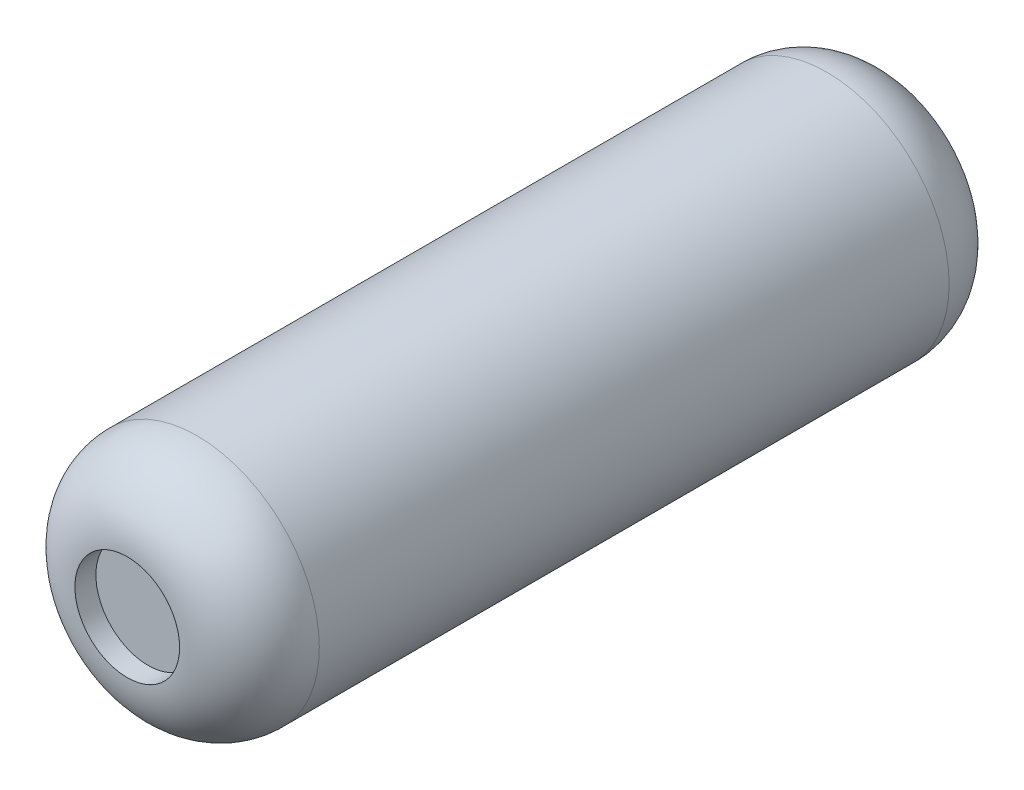
from build123d import *

# Parameters (mm, degrees)
SKETCH1_R          = 44.49044586
EXTRUDE1_DEPTH     = 280
FILLET1_R          = 25.4
SKETCH3_W          = 20
SKETCH3_H          = 10
CUT_EXTRUDE1_DEPTH = 7.62
SKETCH4_R          = 19.05
CUT_EXTRUDE2_DEPTH = 7.62


with BuildPart() as part:
    # Sketch1 → Extrude1 (new body)
    with BuildSketch(Plane.XY):
        Circle(SKETCH1_R)
    extrude(amount=EXTRUDE1_DEPTH)

    # Fillet1
    fillet1_edges = [part.edges().sort_by_distance(p)[0] for p in [
        (-44.49044586, 0, 0),
        (-44.49044586, 0, 280),
    ]]
    fillet(fillet1_edges, radius=FILLET1_R)

    # Sketch3 → Cut-Extrude1 (cut)
    with BuildSketch(Plane(origin=(0, 0, 0), x_dir=(-1, 0, 0), z_dir=(0, 0, -1))):
        Rectangle(SKETCH3_W, SKETCH3_H)
    extrude(amount=-CUT_EXTRUDE1_DEPTH, mode=Mode.SUBTRACT)

    # Sketch4 → Cut-Extrude2 (cut)
    with BuildSketch(Plane.XY.offset(280)):
        Circle(SKETCH4_R)
    extrude(amount=-CUT_EXTRUDE2_DEPTH, mode=Mode.SUBTRACT)


solid = part.part
